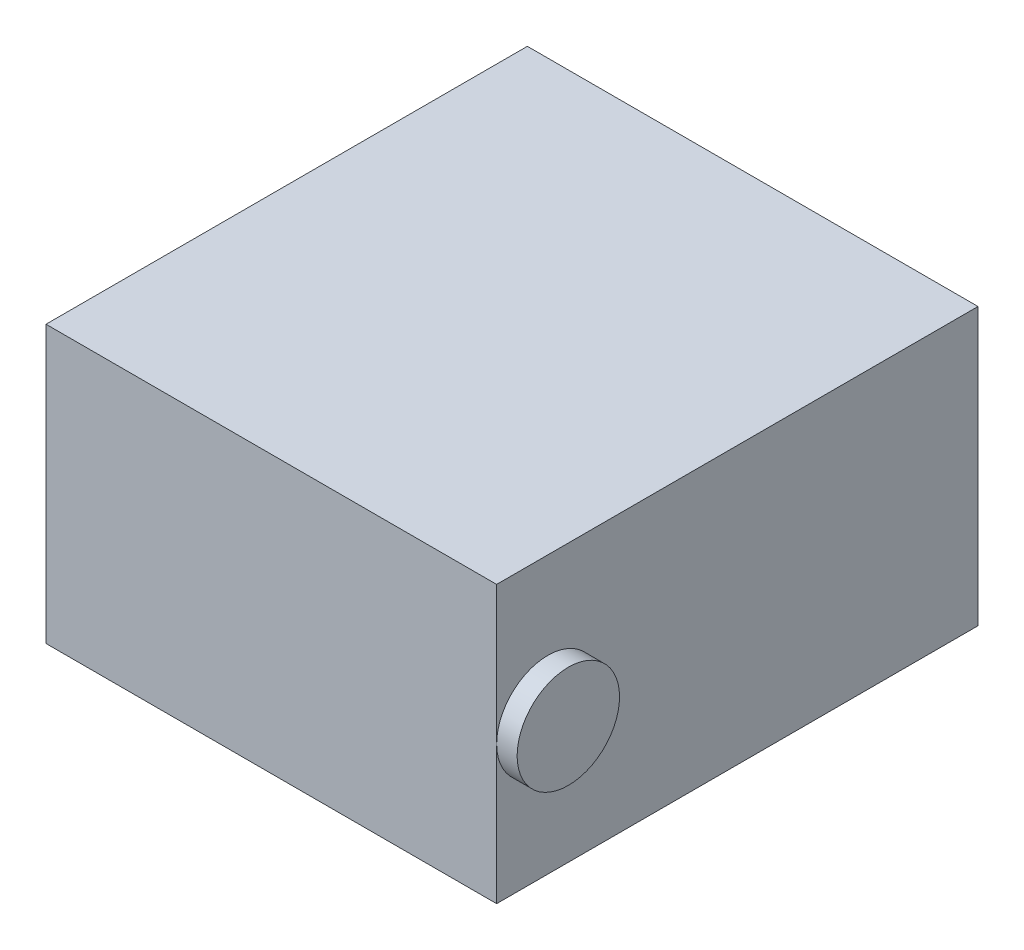
from build123d import *

# Parameters (mm, degrees)
SKETCH1_W           = 139.7
SKETCH1_H           = 149.225
BOSS_EXTRUDE1_DEPTH = 85.725
SKETCH2_W           = 47.625
SKETCH2_H           = 22.225
BOSS_EXTRUDE2_DEPTH = 6.35
SKETCH3_R           = 15.875
BOSS_EXTRUDE3_DEPTH = 6.35
SKETCH4_R           = 1.5875
CUT_EXTRUDE1_DEPTH  = 6.35


with BuildPart() as part:
    # Sketch1 → Boss-Extrude1 (new body)
    with BuildSketch(Plane(origin=(0, 0, 0), x_dir=(1, 0, 0), z_dir=(0, 1, 0))):
        with Locations((69.85, 74.6125)):
            Rectangle(SKETCH1_W, SKETCH1_H)
    extrude(amount=BOSS_EXTRUDE1_DEPTH)

    # Sketch2 → Boss-Extrude2 (add)
    with BuildSketch(Plane.ZY):
        with Locations((-30.1625, 42.8625)):
            Rectangle(SKETCH2_W, SKETCH2_H)
    extrude(amount=BOSS_EXTRUDE2_DEPTH)

    # Sketch3 → Boss-Extrude3 (add)
    with BuildSketch(Plane(origin=(139.7, 0, 0), x_dir=(0, 0, -1), z_dir=(1, 0, 0))):
        with Locations(Location((15.875, 42.8625, 0), (0, 0, 180))):
            Circle(SKETCH3_R)
    extrude(amount=BOSS_EXTRUDE3_DEPTH)

    # Sketch4 → Cut-Extrude1 (cut)
    with BuildSketch(Plane.ZY):
        with Locations((-6.35, 79.375)):
            Circle(SKETCH4_R)
        with Locations((-142.875, 79.375)):
            Circle(SKETCH4_R)
        with Locations((-142.875, 15.875)):
            Circle(SKETCH4_R)
        with Locations((-30.1625, 6.35)):
            Circle(SKETCH4_R)
    extrude(amount=-CUT_EXTRUDE1_DEPTH, mode=Mode.SUBTRACT)


solid = part.part
